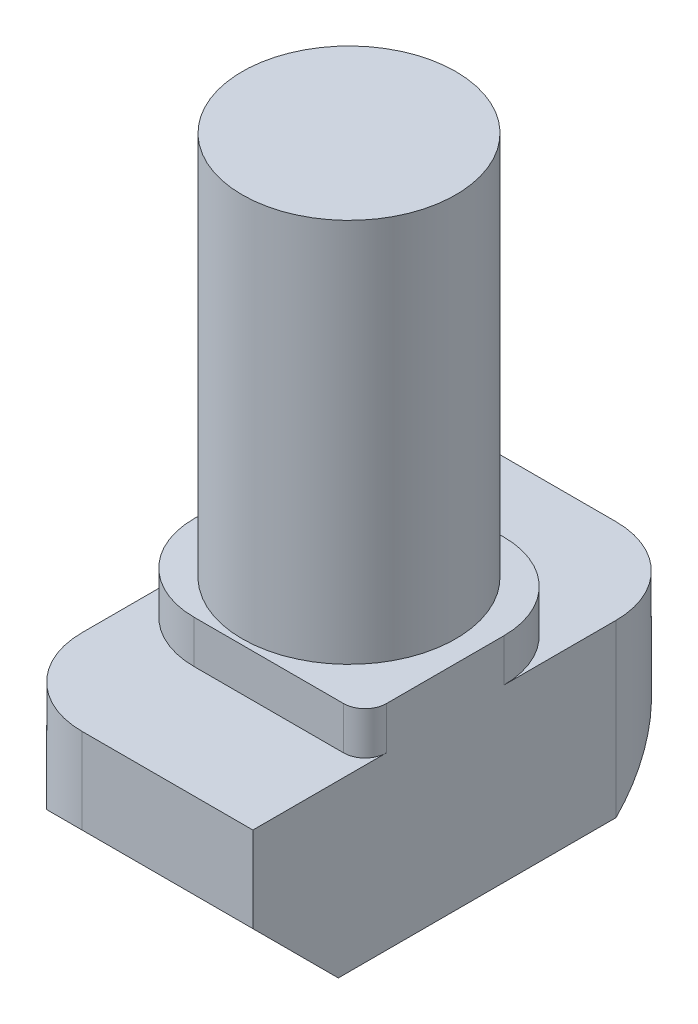
from build123d import *

# Parameters (mm, degrees)
BOSS_EXTRUDE1_DEPTH = 3
FILLET1_R           = 2
FILLET2_R           = 2
FILLET3_R           = 0.5
SKETCH2_W           = 2.5
SKETCH2_H           = 9


with BuildPart() as part:
    # Sketch1 → Boss-Extrude1 (new, symmetric)
    with BuildSketch(Plane(origin=(0, 0, 0), x_dir=(0, 0, -1), z_dir=(1, 0, 0))):
        Polygon((-2.625, 0), (2.625, 0), (2.625, -1), (5.25, -1), (5.25, -3), (3.25, -5), (-3.25, -5), (-5.25, -3), (-5.25, -1), (-2.625, -1), align=None)
    extrude(amount=BOSS_EXTRUDE1_DEPTH, both=True)

    # Fillet1
    fillet1_edges = [part.edges().sort_by_distance(p)[0] for p in [
        (3, -2, -5.25),
        (-3, -2, 5.25),
    ]]
    fillet(fillet1_edges, radius=FILLET1_R)

    # Fillet2
    fillet2_edges = [part.edges().sort_by_distance(p)[0] for p in [
        (3, -0.5, -2.625),
        (-3, -0.5, 2.625),
    ]]
    fillet(fillet2_edges, radius=FILLET2_R)

    # Fillet3
    fillet3_edges = [part.edges().sort_by_distance(p)[0] for p in [
        (-3, -0.5, -2.625),
        (3, -0.5, 2.625),
    ]]
    fillet(fillet3_edges, radius=FILLET3_R)

    # Sketch2 → Revolve1 (revolve)
    with BuildSketch(Plane.XY):
        with Locations((1.25, 4.5)):
            Rectangle(SKETCH2_W, SKETCH2_H)
    revolve(axis=Axis((0, 55, 0), (0, -1, 0)))


solid = part.part
